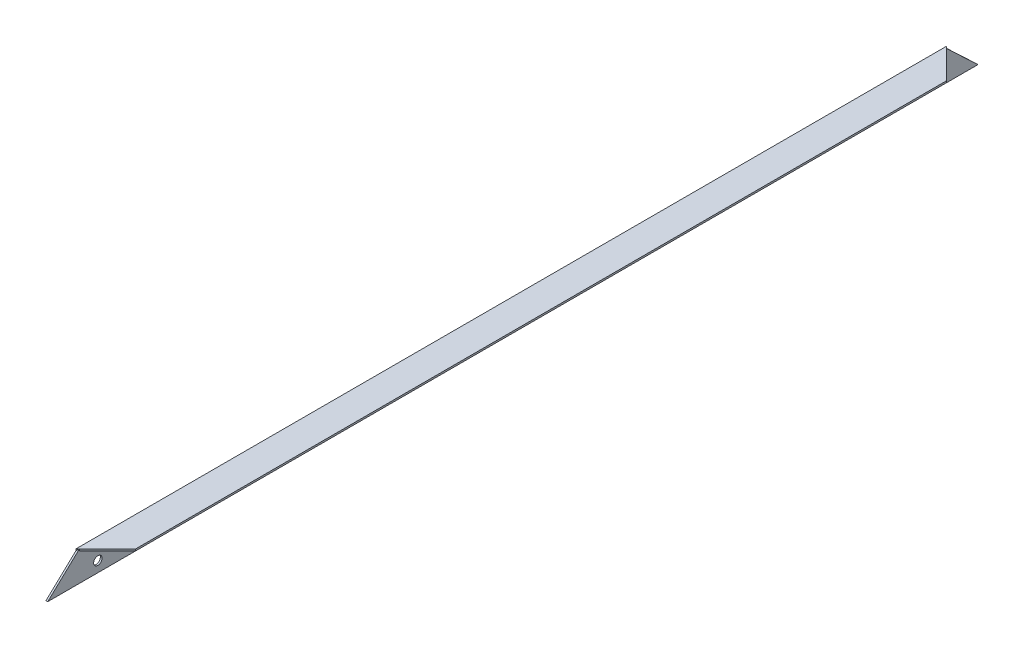
from build123d import *

# Parameters (mm, degrees)
BOSS_EXTRUDE1_DEPTH     = 618.75
CUT_EXTRUDE1_DEPTH      = 10
BOSS_EXTRUDE5_DEPTH     = 2.5
CUT_EXTRUDE2_DEPTH      = 663.834510593
CUT_EXTRUDE2_DEPTH_BACK = 663.834510593
SKETCH5_R               = 6


with BuildPart() as part:
    # Sketch1 → Boss-Extrude1 (new, symmetric)
    with BuildSketch(Plane.XY):
        Polygon((-17.90633676, 20.183505355), (-17.90633676, -22.316494645), (-15.40633676, -22.316494645), (-15.40633676, 17.683505355), (24.59366324, 17.683505355), (24.59366324, 20.183505355), align=None)
    extrude(amount=BOSS_EXTRUDE1_DEPTH, both=True)

    # Sketch2 → Cut-Extrude1 (cut)
    with BuildSketch(Plane(origin=(0, 20.183505355, 0), x_dir=(1, 0, 0), z_dir=(0, 1, 0))):
        Polygon((-17.90633676, 618.75), (24.59366324, 576.25), (24.59366324, 618.75), align=None)
        Polygon((24.59366324, -576.25), (24.59366324, -618.75), (-17.90633676, -618.75), align=None)
    extrude(amount=-CUT_EXTRUDE1_DEPTH, mode=Mode.SUBTRACT)

    # Sketch3 → Boss-Extrude5 (add)
    with BuildSketch(Plane(origin=(-15.40633676, 0, 0), x_dir=(0, 0, -1), z_dir=(1, 0, 0))):
        Polygon((-616.25, 20.183505355), (-661.25, -22.316494645), (-616.25, -22.316494645), align=None)
        Polygon((616.25, 20.183505355), (661.25, -22.316494645), (616.25, -22.316494645), align=None)
    extrude(amount=-BOSS_EXTRUDE5_DEPTH)

    # Sketch5 → Cut-Extrude2 (cut, two sides: drawn at the far end of the back side and taken through both)
    with BuildSketch(Plane(origin=(-15.40633676, 0, 0), x_dir=(0, 0, -1), z_dir=(1, 0, 0)).offset(-CUT_EXTRUDE2_DEPTH_BACK)):
        with Locations(Location((-590, -7.316494645, 0), (0, 0, 90))):
            Circle(SKETCH5_R)
        with Locations(Location((-472, -7.316494645, 0), (0, 0, 90))):
            Circle(SKETCH5_R)
        with Locations(Location((-354, -7.316494645, 0), (0, 0, 90))):
            Circle(SKETCH5_R)
        with Locations(Location((-236, -7.316494645, 0), (0, 0, 90))):
            Circle(SKETCH5_R)
        with Locations(Location((-118, -7.316494645, 0), (0, 0, 90))):
            Circle(SKETCH5_R)
        with Locations(Location((0, -7.316494645, 0), (0, 0, 90))):
            Circle(SKETCH5_R)
        with Locations(Location((118, -7.316494645, 0), (0, 0, 90))):
            Circle(SKETCH5_R)
        with Locations(Location((236, -7.316494645, 0), (0, 0, 90))):
            Circle(SKETCH5_R)
        with Locations(Location((354, -7.316494645, 0), (0, 0, 90))):
            Circle(SKETCH5_R)
        with Locations(Location((472, -7.316494645, 0), (0, 0, 90))):
            Circle(SKETCH5_R)
        with Locations(Location((590, -7.316494645, 0), (0, 0, 90))):
            Circle(SKETCH5_R)
    extrude(amount=CUT_EXTRUDE2_DEPTH + CUT_EXTRUDE2_DEPTH_BACK, mode=Mode.SUBTRACT)


solid = part.part
